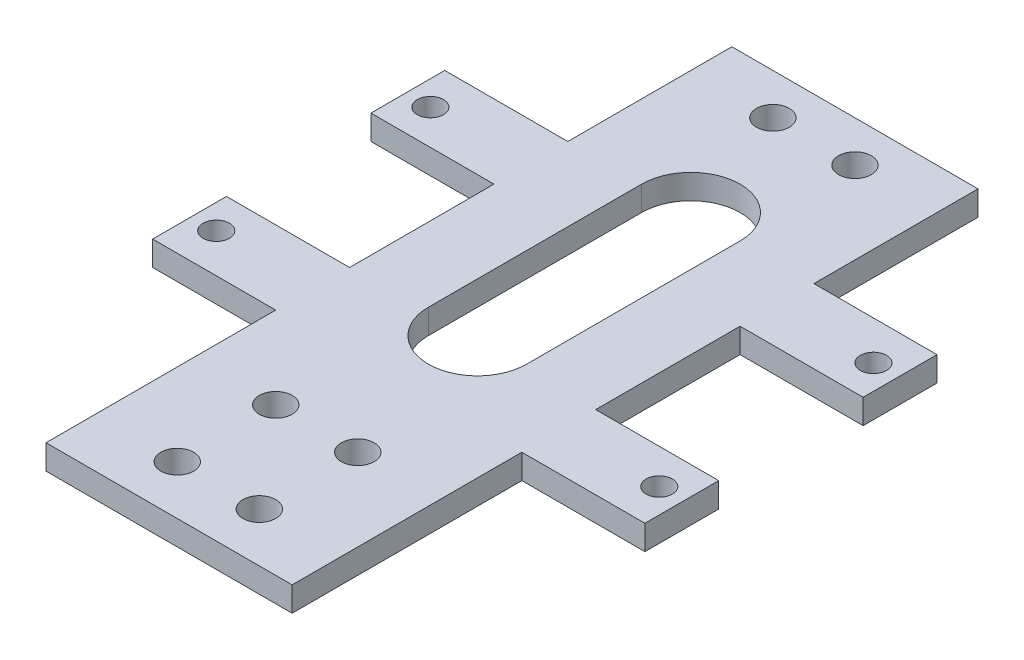
from build123d import *

# Parameters (mm, degrees)
EXTRUDE_1_DEPTH     = 3
SKETCH_2_R          = 1.6
CUT_EXTRUDE_1_DEPTH = 3
SKETCH_3_R          = 2
CUT_EXTRUDE_2_DEPTH = 3
CUT_EXTRUDE_3_DEPTH = 3


with BuildPart() as part:
    # 草图1 → 凸台-拉伸1 (new body)
    with BuildSketch(Plane(origin=(0, 0, 0), x_dir=(1, 0, 0), z_dir=(0, 1, 0))):
        Polygon((0, 0), (15, 0), (15, -28), (45, -28), (45, 0), (60, 0), (60, 9), (45, 9), (45, 26.6), (60, 26.6), (60, 35.6), (45, 35.6), (45, 55.6), (15, 55.6), (15, 35.6), (0, 35.6), (0, 26.6), (15, 26.6), (15, 9), (0, 9), align=None)
    extrude(amount=EXTRUDE_1_DEPTH)

    # 草图2 → 切除-拉伸1 (cut)
    with BuildSketch(Plane(origin=(0, 3, 0), x_dir=(1, 0, 0), z_dir=(0, 1, 0))):
        with Locations(Location((3, 4.75, 0), (0, 0, 270))):
            Circle(SKETCH_2_R)
        with Locations(Location((3, 30.85, 0), (0, 0, 270))):
            Circle(SKETCH_2_R)
        with Locations(Location((57, 30.85, 0), (0, 0, 270))):
            Circle(SKETCH_2_R)
        with Locations(Location((57, 4.75, 0), (0, 0, 270))):
            Circle(SKETCH_2_R)
    extrude(amount=-CUT_EXTRUDE_1_DEPTH, mode=Mode.SUBTRACT)

    # 草图3 → 切除-拉伸2 (cut)
    with BuildSketch(Plane(origin=(0, 3, 0), x_dir=(1, 0, 0), z_dir=(0, 1, 0))):
        with Locations(Location((25, 50.6, 0), (0, 0, 270))):
            Circle(SKETCH_3_R)
        with Locations(Location((35, 50.6, 0), (0, 0, 270))):
            Circle(SKETCH_3_R)
        with Locations(Location((35, -22, 0), (0, 0, 270))):
            Circle(SKETCH_3_R)
        with Locations(Location((25, -22, 0), (0, 0, 270))):
            Circle(SKETCH_3_R)
        with Locations(Location((25, -10, 0), (0, 0, 270))):
            Circle(SKETCH_3_R)
        with Locations(Location((35, -10, 0), (0, 0, 270))):
            Circle(SKETCH_3_R)
    extrude(amount=-CUT_EXTRUDE_2_DEPTH, mode=Mode.SUBTRACT)

    # 草图4 → 切除-拉伸3 (cut)
    with BuildSketch(Plane(origin=(0, 3, 0), x_dir=(1, 0, 0), z_dir=(0, 1, 0))):
        with BuildLine():
            Line((36, 35.6), (36, 9.6))
            ThreePointArc((36, 9.6), (30, 3.6), (24, 9.6))
            Line((24, 9.6), (24, 35.6))
            ThreePointArc((24, 35.6), (30, 41.6), (36, 35.6))
        make_face()
    extrude(amount=-CUT_EXTRUDE_3_DEPTH, mode=Mode.SUBTRACT)


solid = part.part
